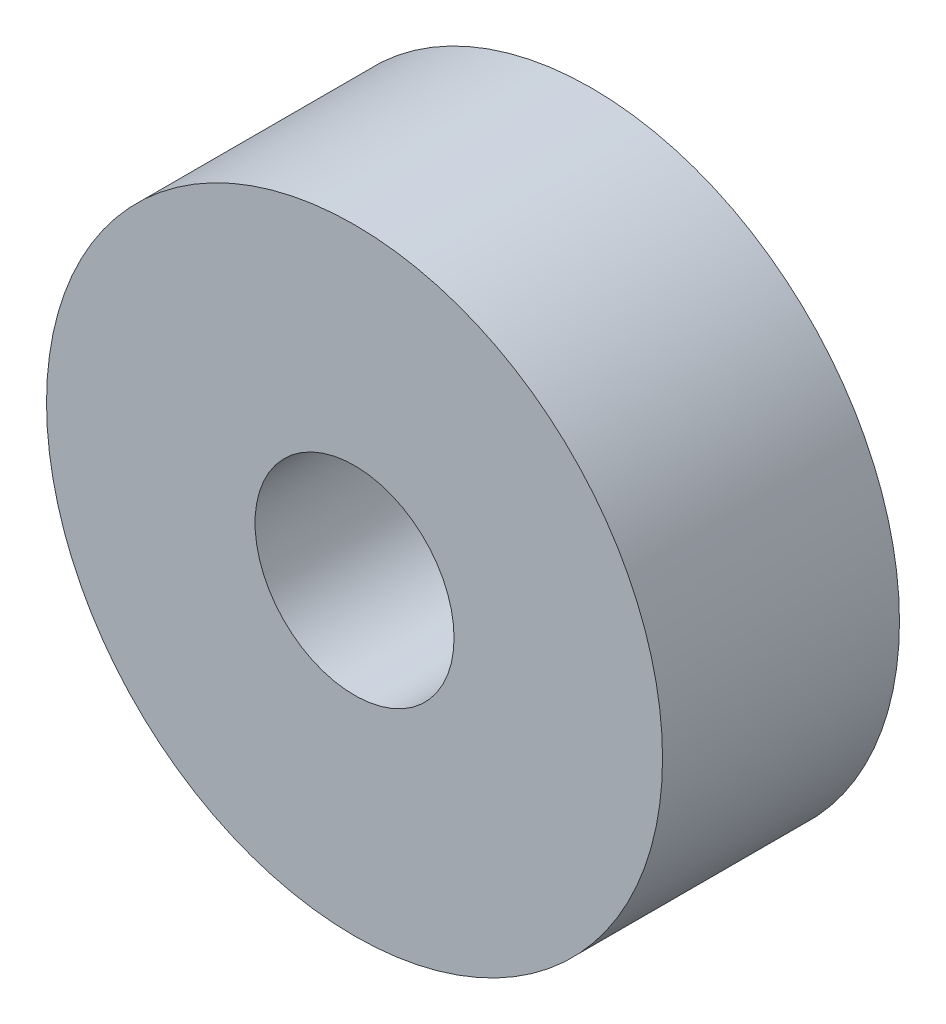
from build123d import *

# Parameters (mm, degrees)
SKETCH_1_R      = 6.5
SKETCH_1_R_2    = 2.1
EXTRUDE_1_DEPTH = 5


with BuildPart() as part:
    # 草图1 → 凸台-拉伸1 (new body)
    with BuildSketch(Plane.XY):
        Circle(SKETCH_1_R)
        Circle(SKETCH_1_R_2, mode=Mode.SUBTRACT)
    extrude(amount=EXTRUDE_1_DEPTH)


solid = part.part
